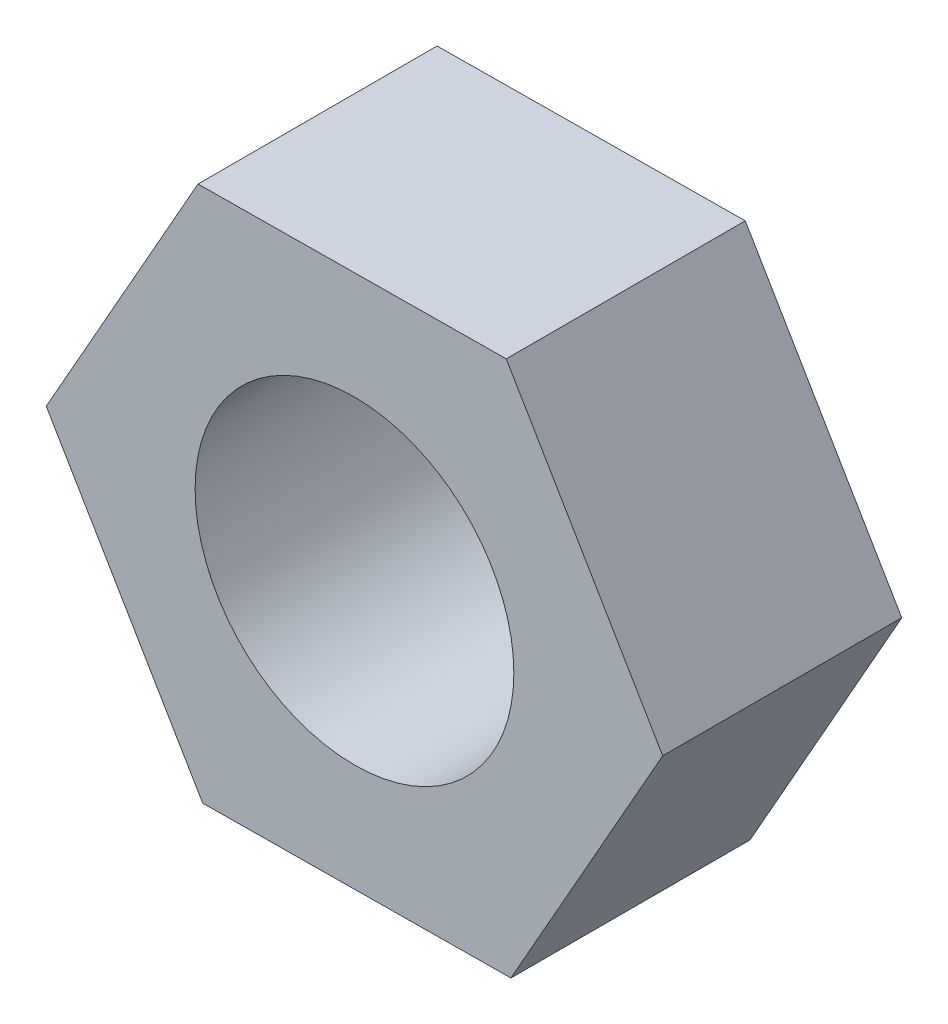
from build123d import *

# Parameters (mm, degrees)
SKETCH_1_R      = 2
EXTRUDE_1_DEPTH = 3


with BuildPart() as part:
    # 草图1 → 凸台-拉伸1 (new body)
    with BuildSketch(Plane.XY):
        Polygon((1.963536694, -3.332845178), (3.868096939, 0.034050069), (1.904560244, 3.366895248), (-1.963536694, 3.332845178), (-3.868096939, -0.034050069), (-1.904560244, -3.366895248), align=None)
        Circle(SKETCH_1_R, mode=Mode.SUBTRACT)
    extrude(amount=EXTRUDE_1_DEPTH)


solid = part.part
